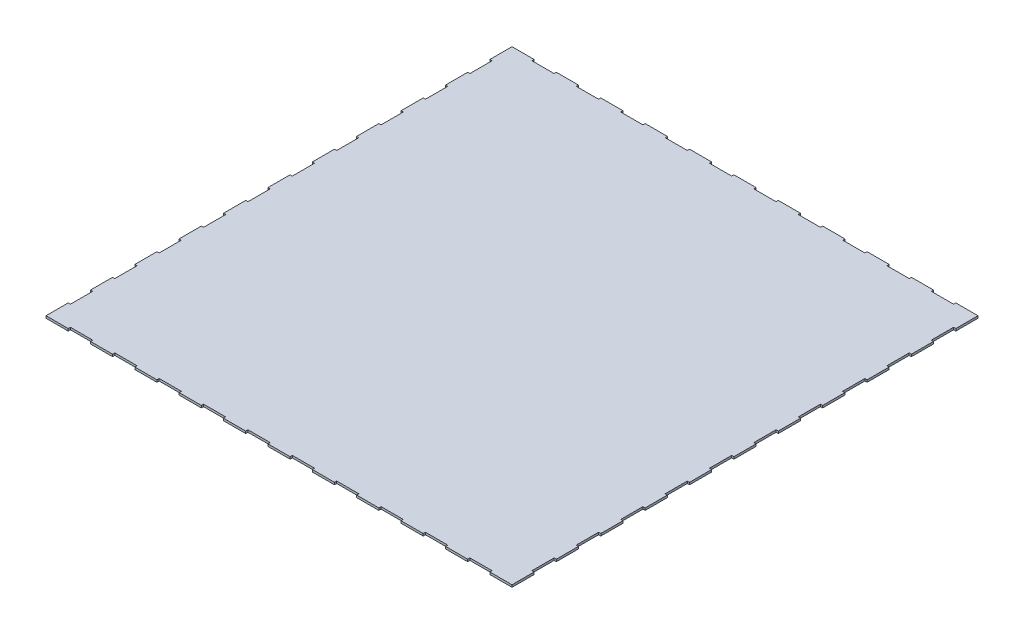
from build123d import *

# Parameters (mm, degrees)
SKETCH1_W               = 630
SKETCH1_H               = 630
BOSS_EXTRUDE1_DEPTH     = 3
SKETCH3_W               = 3
SKETCH3_H               = 30
CUT_EXTRUDE2_DEPTH      = 3
LPATTERN2_COUNT         = 10
LPATTERN2_PITCH         = 60
MIRROR1_COPY_1_SKETCH_W = 3
MIRROR1_COPY_1_SKETCH_H = 30
MIRROR1_COPY_1_DEPTH    = 3
MIRROR1_COPY_2_SKETCH_W = 3
MIRROR1_COPY_2_SKETCH_H = 30
MIRROR1_COPY_2_DEPTH    = 3
MIRROR1_COPY_3_SKETCH_W = 3
MIRROR1_COPY_3_SKETCH_H = 30
MIRROR1_COPY_3_DEPTH    = 3
MIRROR1_COPY_4_SKETCH_W = 3
MIRROR1_COPY_4_SKETCH_H = 30
MIRROR1_COPY_4_DEPTH    = 3
MIRROR1_COPY_5_SKETCH_W = 3
MIRROR1_COPY_5_SKETCH_H = 30
MIRROR1_COPY_5_DEPTH    = 3
MIRROR1_COPY_6_SKETCH_W = 3
MIRROR1_COPY_6_SKETCH_H = 30
MIRROR1_COPY_6_DEPTH    = 3
MIRROR1_COPY_7_SKETCH_W = 3
MIRROR1_COPY_7_SKETCH_H = 30
MIRROR1_COPY_7_DEPTH    = 3
MIRROR1_COPY_8_SKETCH_W = 3
MIRROR1_COPY_8_SKETCH_H = 30
MIRROR1_COPY_8_DEPTH    = 3
MIRROR1_COPY_9_SKETCH_W = 3
MIRROR1_COPY_9_SKETCH_H = 30
MIRROR1_COPY_9_DEPTH    = 3
SKETCH5_W               = 30
SKETCH5_H               = 3
CUT_EXTRUDE3_DEPTH      = 3
LPATTERN3_COUNT         = 10
LPATTERN3_PITCH         = 60
MIRROR2_COPY_1_SKETCH_W = 30
MIRROR2_COPY_1_SKETCH_H = 3
MIRROR2_COPY_1_DEPTH    = 3
MIRROR2_COPY_2_SKETCH_W = 30
MIRROR2_COPY_2_SKETCH_H = 3
MIRROR2_COPY_2_DEPTH    = 3
MIRROR2_COPY_3_SKETCH_W = 30
MIRROR2_COPY_3_SKETCH_H = 3
MIRROR2_COPY_3_DEPTH    = 3
MIRROR2_COPY_4_SKETCH_W = 30
MIRROR2_COPY_4_SKETCH_H = 3
MIRROR2_COPY_4_DEPTH    = 3
MIRROR2_COPY_5_SKETCH_W = 30
MIRROR2_COPY_5_SKETCH_H = 3
MIRROR2_COPY_5_DEPTH    = 3
MIRROR2_COPY_6_SKETCH_W = 30
MIRROR2_COPY_6_SKETCH_H = 3
MIRROR2_COPY_6_DEPTH    = 3
MIRROR2_COPY_7_SKETCH_W = 30
MIRROR2_COPY_7_SKETCH_H = 3
MIRROR2_COPY_7_DEPTH    = 3
MIRROR2_COPY_8_SKETCH_W = 30
MIRROR2_COPY_8_SKETCH_H = 3
MIRROR2_COPY_8_DEPTH    = 3
MIRROR2_COPY_9_SKETCH_W = 30
MIRROR2_COPY_9_SKETCH_H = 3
MIRROR2_COPY_9_DEPTH    = 3


with BuildPart() as part:
    # Sketch1 → Boss-Extrude1 (new body)
    with BuildSketch(Plane(origin=(0, 0, 0), x_dir=(1, 0, 0), z_dir=(0, 1, 0))):
        Rectangle(SKETCH1_W, SKETCH1_H)
    extrude(amount=BOSS_EXTRUDE1_DEPTH)

    # Sketch3 → Cut-Extrude2 (cut)
    with BuildSketch(Plane(origin=(0, 3, 0), x_dir=(1, 0, 0), z_dir=(0, 1, 0))):
        with Locations((-313.5, -270.006843512)):
            Rectangle(SKETCH3_W, SKETCH3_H)
    cut_extrude2 = extrude(amount=-CUT_EXTRUDE2_DEPTH, mode=Mode.SUBTRACT)

    # LPattern2: Cut-Extrude2 ×10
    with Locations(*[(0, 0, -i * LPATTERN2_PITCH) for i in range(1, LPATTERN2_COUNT)]):
        add(cut_extrude2, mode=Mode.SUBTRACT)

    # Mirror1: Cut-Extrude2 across plane
    add(cut_extrude2.mirror(Plane(origin=(0, 0, 0), x_dir=(0, 0, 1), z_dir=(1, 0, 0))), mode=Mode.SUBTRACT)

    # Mirror1 copy 1 sketch → Mirror1 copy 1 (cut)
    with BuildSketch(Plane(origin=(0, 3, -60), x_dir=(-1, 0, 0), z_dir=(0, 1, 0))):
        with Locations((-313.5, 270.006843512)):
            Rectangle(MIRROR1_COPY_1_SKETCH_W, MIRROR1_COPY_1_SKETCH_H)
    extrude(amount=-MIRROR1_COPY_1_DEPTH, mode=Mode.SUBTRACT)

    # Mirror1 copy 2 sketch → Mirror1 copy 2 (cut)
    with BuildSketch(Plane(origin=(0, 3, -120), x_dir=(-1, 0, 0), z_dir=(0, 1, 0))):
        with Locations((-313.5, 270.006843512)):
            Rectangle(MIRROR1_COPY_2_SKETCH_W, MIRROR1_COPY_2_SKETCH_H)
    extrude(amount=-MIRROR1_COPY_2_DEPTH, mode=Mode.SUBTRACT)

    # Mirror1 copy 3 sketch → Mirror1 copy 3 (cut)
    with BuildSketch(Plane(origin=(0, 3, -180), x_dir=(-1, 0, 0), z_dir=(0, 1, 0))):
        with Locations((-313.5, 270.006843512)):
            Rectangle(MIRROR1_COPY_3_SKETCH_W, MIRROR1_COPY_3_SKETCH_H)
    extrude(amount=-MIRROR1_COPY_3_DEPTH, mode=Mode.SUBTRACT)

    # Mirror1 copy 4 sketch → Mirror1 copy 4 (cut)
    with BuildSketch(Plane(origin=(0, 3, -240), x_dir=(-1, 0, 0), z_dir=(0, 1, 0))):
        with Locations((-313.5, 270.006843512)):
            Rectangle(MIRROR1_COPY_4_SKETCH_W, MIRROR1_COPY_4_SKETCH_H)
    extrude(amount=-MIRROR1_COPY_4_DEPTH, mode=Mode.SUBTRACT)

    # Mirror1 copy 5 sketch → Mirror1 copy 5 (cut)
    with BuildSketch(Plane(origin=(0, 3, -300), x_dir=(-1, 0, 0), z_dir=(0, 1, 0))):
        with Locations((-313.5, 270.006843512)):
            Rectangle(MIRROR1_COPY_5_SKETCH_W, MIRROR1_COPY_5_SKETCH_H)
    extrude(amount=-MIRROR1_COPY_5_DEPTH, mode=Mode.SUBTRACT)

    # Mirror1 copy 6 sketch → Mirror1 copy 6 (cut)
    with BuildSketch(Plane(origin=(0, 3, -360), x_dir=(-1, 0, 0), z_dir=(0, 1, 0))):
        with Locations((-313.5, 270.006843512)):
            Rectangle(MIRROR1_COPY_6_SKETCH_W, MIRROR1_COPY_6_SKETCH_H)
    extrude(amount=-MIRROR1_COPY_6_DEPTH, mode=Mode.SUBTRACT)

    # Mirror1 copy 7 sketch → Mirror1 copy 7 (cut)
    with BuildSketch(Plane(origin=(0, 3, -420), x_dir=(-1, 0, 0), z_dir=(0, 1, 0))):
        with Locations((-313.5, 270.006843512)):
            Rectangle(MIRROR1_COPY_7_SKETCH_W, MIRROR1_COPY_7_SKETCH_H)
    extrude(amount=-MIRROR1_COPY_7_DEPTH, mode=Mode.SUBTRACT)

    # Mirror1 copy 8 sketch → Mirror1 copy 8 (cut)
    with BuildSketch(Plane(origin=(0, 3, -480), x_dir=(-1, 0, 0), z_dir=(0, 1, 0))):
        with Locations((-313.5, 270.006843512)):
            Rectangle(MIRROR1_COPY_8_SKETCH_W, MIRROR1_COPY_8_SKETCH_H)
    extrude(amount=-MIRROR1_COPY_8_DEPTH, mode=Mode.SUBTRACT)

    # Mirror1 copy 9 sketch → Mirror1 copy 9 (cut)
    with BuildSketch(Plane(origin=(0, 3, -540), x_dir=(-1, 0, 0), z_dir=(0, 1, 0))):
        with Locations((-313.5, 270.006843512)):
            Rectangle(MIRROR1_COPY_9_SKETCH_W, MIRROR1_COPY_9_SKETCH_H)
    extrude(amount=-MIRROR1_COPY_9_DEPTH, mode=Mode.SUBTRACT)

    # Sketch5 → Cut-Extrude3 (cut)
    with BuildSketch(Plane(origin=(0, 3, 0), x_dir=(1, 0, 0), z_dir=(0, 1, 0))):
        with Locations((-270.000314512, -313.5)):
            Rectangle(SKETCH5_W, SKETCH5_H)
    cut_extrude3 = extrude(amount=-CUT_EXTRUDE3_DEPTH, mode=Mode.SUBTRACT)

    # LPattern3: Cut-Extrude3 ×10
    with Locations(*[(i * LPATTERN3_PITCH, 0, 0) for i in range(1, LPATTERN3_COUNT)]):
        add(cut_extrude3, mode=Mode.SUBTRACT)

    # Mirror2: Cut-Extrude3 across plane
    add(cut_extrude3.mirror(Plane.XY), mode=Mode.SUBTRACT)

    # Mirror2 copy 1 sketch → Mirror2 copy 1 (cut)
    with BuildSketch(Plane(origin=(60, 3, 0), x_dir=(1, 0, 0), z_dir=(0, 1, 0))):
        with Locations((-270.000314512, 313.5)):
            Rectangle(MIRROR2_COPY_1_SKETCH_W, MIRROR2_COPY_1_SKETCH_H)
    extrude(amount=-MIRROR2_COPY_1_DEPTH, mode=Mode.SUBTRACT)

    # Mirror2 copy 2 sketch → Mirror2 copy 2 (cut)
    with BuildSketch(Plane(origin=(120, 3, 0), x_dir=(1, 0, 0), z_dir=(0, 1, 0))):
        with Locations((-270.000314512, 313.5)):
            Rectangle(MIRROR2_COPY_2_SKETCH_W, MIRROR2_COPY_2_SKETCH_H)
    extrude(amount=-MIRROR2_COPY_2_DEPTH, mode=Mode.SUBTRACT)

    # Mirror2 copy 3 sketch → Mirror2 copy 3 (cut)
    with BuildSketch(Plane(origin=(180, 3, 0), x_dir=(1, 0, 0), z_dir=(0, 1, 0))):
        with Locations((-270.000314512, 313.5)):
            Rectangle(MIRROR2_COPY_3_SKETCH_W, MIRROR2_COPY_3_SKETCH_H)
    extrude(amount=-MIRROR2_COPY_3_DEPTH, mode=Mode.SUBTRACT)

    # Mirror2 copy 4 sketch → Mirror2 copy 4 (cut)
    with BuildSketch(Plane(origin=(240, 3, 0), x_dir=(1, 0, 0), z_dir=(0, 1, 0))):
        with Locations((-270.000314512, 313.5)):
            Rectangle(MIRROR2_COPY_4_SKETCH_W, MIRROR2_COPY_4_SKETCH_H)
    extrude(amount=-MIRROR2_COPY_4_DEPTH, mode=Mode.SUBTRACT)

    # Mirror2 copy 5 sketch → Mirror2 copy 5 (cut)
    with BuildSketch(Plane(origin=(300, 3, 0), x_dir=(1, 0, 0), z_dir=(0, 1, 0))):
        with Locations((-270.000314512, 313.5)):
            Rectangle(MIRROR2_COPY_5_SKETCH_W, MIRROR2_COPY_5_SKETCH_H)
    extrude(amount=-MIRROR2_COPY_5_DEPTH, mode=Mode.SUBTRACT)

    # Mirror2 copy 6 sketch → Mirror2 copy 6 (cut)
    with BuildSketch(Plane(origin=(360, 3, 0), x_dir=(1, 0, 0), z_dir=(0, 1, 0))):
        with Locations((-270.000314512, 313.5)):
            Rectangle(MIRROR2_COPY_6_SKETCH_W, MIRROR2_COPY_6_SKETCH_H)
    extrude(amount=-MIRROR2_COPY_6_DEPTH, mode=Mode.SUBTRACT)

    # Mirror2 copy 7 sketch → Mirror2 copy 7 (cut)
    with BuildSketch(Plane(origin=(420, 3, 0), x_dir=(1, 0, 0), z_dir=(0, 1, 0))):
        with Locations((-270.000314512, 313.5)):
            Rectangle(MIRROR2_COPY_7_SKETCH_W, MIRROR2_COPY_7_SKETCH_H)
    extrude(amount=-MIRROR2_COPY_7_DEPTH, mode=Mode.SUBTRACT)

    # Mirror2 copy 8 sketch → Mirror2 copy 8 (cut)
    with BuildSketch(Plane(origin=(480, 3, 0), x_dir=(1, 0, 0), z_dir=(0, 1, 0))):
        with Locations((-270.000314512, 313.5)):
            Rectangle(MIRROR2_COPY_8_SKETCH_W, MIRROR2_COPY_8_SKETCH_H)
    extrude(amount=-MIRROR2_COPY_8_DEPTH, mode=Mode.SUBTRACT)

    # Mirror2 copy 9 sketch → Mirror2 copy 9 (cut)
    with BuildSketch(Plane(origin=(540, 3, 0), x_dir=(1, 0, 0), z_dir=(0, 1, 0))):
        with Locations((-270.000314512, 313.5)):
            Rectangle(MIRROR2_COPY_9_SKETCH_W, MIRROR2_COPY_9_SKETCH_H)
    extrude(amount=-MIRROR2_COPY_9_DEPTH, mode=Mode.SUBTRACT)


solid = part.part
